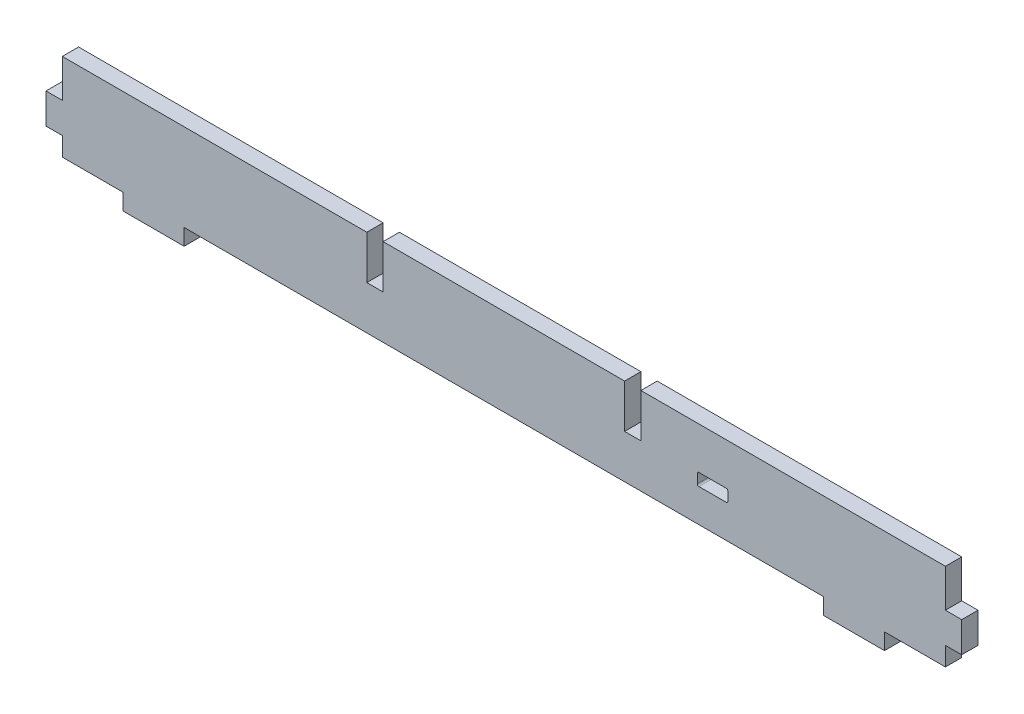
from build123d import *

# Parameters (mm, degrees)
BOSS_EXTRUDE1_DEPTH = 5.35


with BuildPart() as part:
    # Model → Boss-Extrude1 (new body)
    with BuildSketch(Plane.XY):
        Polygon((-145, 0), (-125, 0), (-125, -5.35), (-105, -5.35), (-105, 0), (105, 0), (105, -5.35), (125, -5.35), (125, 0), (145, 0), (145, 6.15), (150.35, 6.15), (150.35, 16.15), (145, 16.15), (145, 28.65), (45, 28.65), (45, 14.325), (39.65, 14.325), (39.65, 28.65), (-39.65, 28.65), (-39.65, 14.325), (-45, 14.325), (-45, 28.65), (-145, 28.65), (-145, 16.15), (-150.35, 16.15), (-150.35, 6.15), (-145, 6.15), align=None)
        with BuildLine():
            Line((64.04, 14.85), (73.04, 14.85))
            ThreePointArc((73.04, 14.85), (73.393553391, 14.703553391), (73.54, 14.35))
            Line((73.54, 14.35), (73.54, 11.35))
            ThreePointArc((73.54, 11.35), (73.393553391, 10.996446609), (73.04, 10.85))
            Line((73.04, 10.85), (64.04, 10.85))
            ThreePointArc((64.04, 10.85), (63.686446609, 10.996446609), (63.54, 11.35))
            Line((63.54, 11.35), (63.54, 14.35))
            ThreePointArc((63.54, 14.35), (63.686446609, 14.703553391), (64.04, 14.85))
        make_face(mode=Mode.SUBTRACT)
    extrude(amount=BOSS_EXTRUDE1_DEPTH)


solid = part.part
